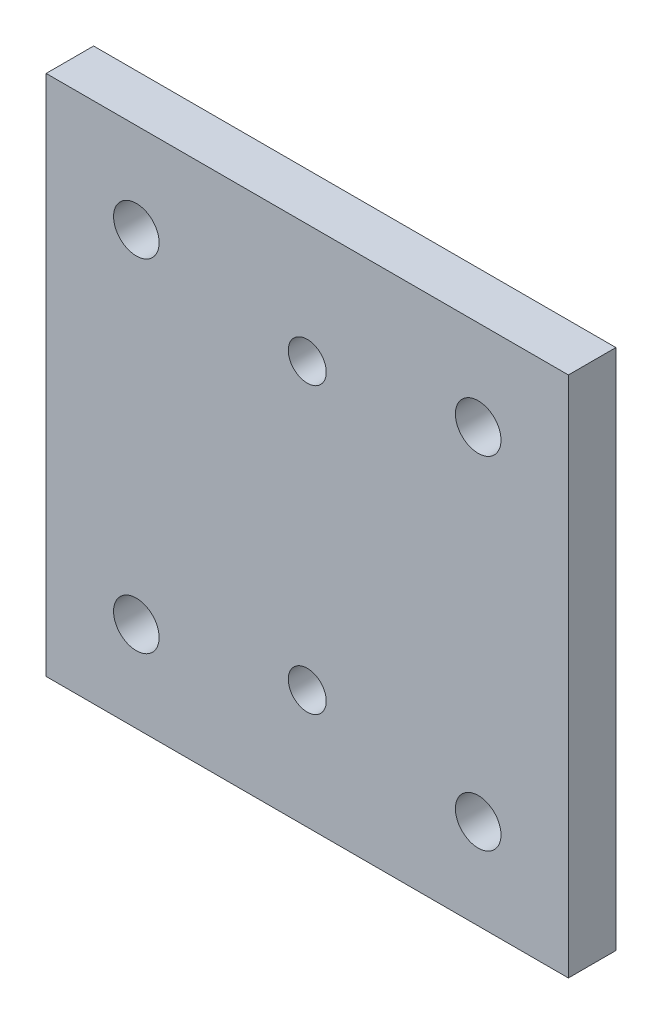
from build123d import *

# Parameters (mm, degrees)
SKETCH1_W                  = 55
SKETCH1_H                  = 55
BOSS_EXTRUDE1_DEPTH        = 2.5
F_4_8_4_8_DIAMETER_HOLE1_D = 4.8
LPATTERN1_COUNT            = 2
LPATTERN1_PITCH            = 36
LPATTERN1_COUNT_DIR2       = 2
LPATTERN1_PITCH_DIR2       = 36
SKETCH4_R                  = 2
CUT_EXTRUDE1_DEPTH         = 40.210967853


with BuildPart() as part:
    # Sketch1 → Boss-Extrude1 (new, symmetric)
    with BuildSketch(Plane.XY):
        Rectangle(SKETCH1_W, SKETCH1_H)
    extrude(amount=BOSS_EXTRUDE1_DEPTH, both=True)

    # Ø4.8 (4.8) Diameter Hole1 (through all)
    with Locations(Plane.XY.offset(2.5)):
        with Locations((18, 18)):
            f_4_8_4_8_diameter_hole1 = Hole(F_4_8_4_8_DIAMETER_HOLE1_D / 2)

    # LPattern1: 4.8 _4.8_ Diameter Hole1 2 × 2
    with Locations(*[(-i * LPATTERN1_PITCH, -j * LPATTERN1_PITCH_DIR2, 0) for i in range(LPATTERN1_COUNT) for j in range(LPATTERN1_COUNT_DIR2) if (i, j) != (0, 0)]):
        add(f_4_8_4_8_diameter_hole1, mode=Mode.SUBTRACT)

    # Sketch4 → Cut-Extrude1 (cut, through all)
    with BuildSketch(Plane.XY.offset(2.5)):
        with Locations((0, 15)):
            Circle(SKETCH4_R)
        with Locations((0, -15)):
            Circle(SKETCH4_R)
    extrude(amount=-CUT_EXTRUDE1_DEPTH, mode=Mode.SUBTRACT)


solid = part.part
